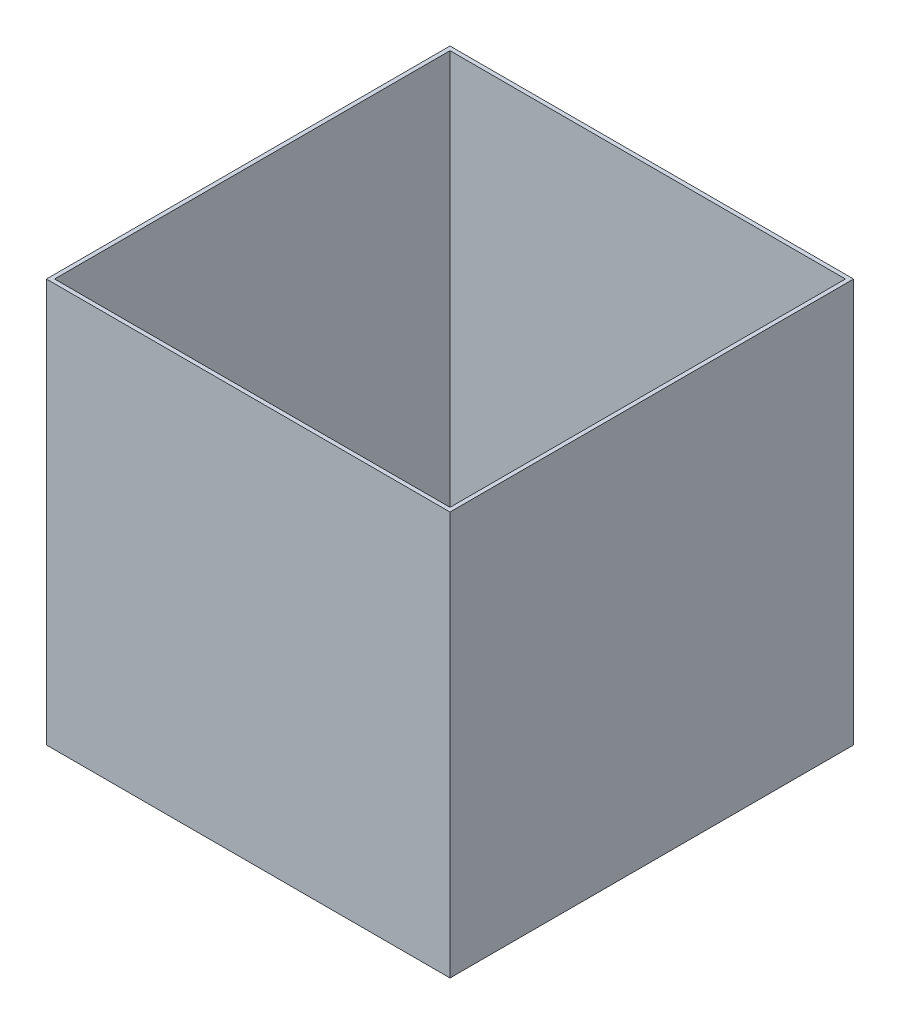
from build123d import *

# Parameters (mm, degrees)
SKETCH1_W           = 50
SKETCH1_H           = 50
BOSS_EXTRUDE1_DEPTH = 50
SHELL1_T            = -0.5


with BuildPart() as part:
    # Sketch1 → Boss-Extrude1 (new body)
    with BuildSketch(Plane(origin=(0, 0, 0), x_dir=(1, 0, 0), z_dir=(0, 1, 0))):
        Rectangle(SKETCH1_W, SKETCH1_H)
    extrude(amount=BOSS_EXTRUDE1_DEPTH)

    # Shell1
    shell1_openings = [part.faces().sort_by_distance(p)[0] for p in [
        (0, 50, 0),
    ]]
    offset(amount=SHELL1_T, openings=shell1_openings, kind=Kind.INTERSECTION)


solid = part.part
